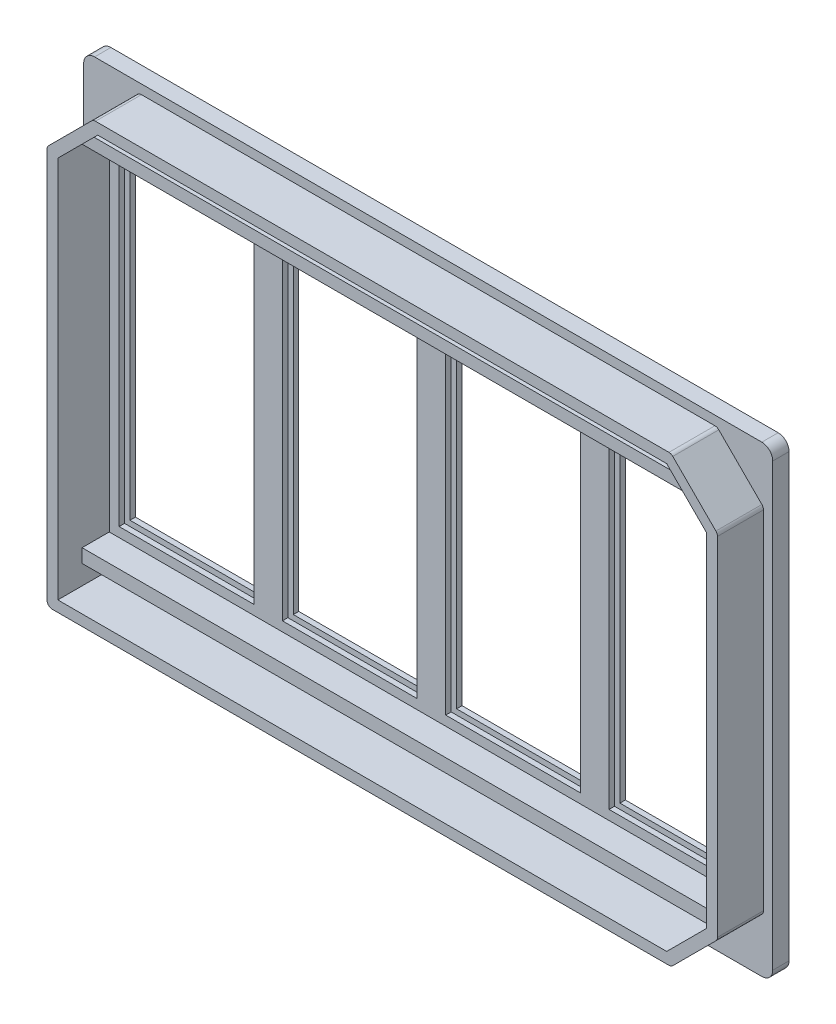
from build123d import *

# Parameters (mm, degrees)
SKETCH1_W           = 126.56
SKETCH1_H           = 85
BOSS_EXTRUDE1_DEPTH = 3
SKETCH2_W           = 123.16
SKETCH2_H           = 81.6
BOSS_EXTRUDE2_DEPTH = 8.45
CUT_EXTRUDE1_DEPTH  = 8.45
FILLET1_R           = 1
SHELL1_T            = -2
FILLET2_R           = 2
SKETCH4_W           = 24.75
SKETCH4_H           = 60.75
CUT_EXTRUDE2_DEPTH  = 1
SKETCH5_W           = 22.75
SKETCH5_H           = 58.75
CUT_EXTRUDE3_DEPTH  = 1
BOSS_EXTRUDE4_DEPTH = 5


with BuildPart() as part:
    # Sketch1 → Boss-Extrude1 (new body)
    with BuildSketch(Plane.XY):
        with Locations((63.28, 42.5)):
            Rectangle(SKETCH1_W, SKETCH1_H)
    extrude(amount=BOSS_EXTRUDE1_DEPTH)

    # Sketch2 → Boss-Extrude2 (add)
    with BuildSketch(Plane.XY.offset(3)):
        with Locations((63.28, 42.5)):
            Rectangle(SKETCH2_W, SKETCH2_H)
    extrude(amount=BOSS_EXTRUDE2_DEPTH)

    # Sketch3 → Cut-Extrude1 (cut)
    with BuildSketch(Plane.XY.offset(11.45)):
        Polygon((1.7, 83.3), (1.7, 74.8), (10.2, 83.3), align=None)
        Polygon((124.86, 83.3), (116.36, 83.3), (124.86, 74.8), align=None)
        Polygon((124.86, 1.7), (124.86, 10.2), (116.36, 1.7), align=None)
    extrude(amount=-CUT_EXTRUDE1_DEPTH, mode=Mode.SUBTRACT)

    # Fillet1
    fillet1_edges = [part.edges().sort_by_distance(p)[0] for p in [
        (1.7, 1.7, 7.225),
        (10.2, 83.3, 7.225),
        (1.7, 74.8, 7.225),
        (124.86, 74.8, 7.225),
        (116.36, 83.3, 7.225),
        (116.36, 1.7, 7.225),
        (124.86, 10.2, 7.225),
    ]]
    fillet(fillet1_edges, radius=FILLET1_R)

    # Shell1
    shell1_openings = [part.faces().sort_by_distance(p)[0] for p in [
        (63.067597632, 42.362751228, 11.45),
    ]]
    offset(amount=SHELL1_T, openings=shell1_openings, kind=Kind.INTERSECTION)

    # Fillet2
    fillet2_edges = [part.edges().sort_by_distance(p)[0] for p in [
        (0, 85, 1.5),
        (126.56, 85, 1.5),
        (126.56, 0, 1.5),
        (0, 0, 1.5),
    ]]
    fillet(fillet2_edges, radius=FILLET2_R)

    # Sketch4 → Cut-Extrude2 (cut)
    with BuildSketch(Plane.XY.offset(2)):
        with Locations((17.875, 41.925)):
            Rectangle(SKETCH4_W, SKETCH4_H)
        with Locations((47.875, 41.925)):
            Rectangle(SKETCH4_W, SKETCH4_H)
        with Locations((77.875, 41.925)):
            Rectangle(SKETCH4_W, SKETCH4_H)
        with Locations((107.875, 41.925)):
            Rectangle(SKETCH4_W, SKETCH4_H)
    extrude(amount=-CUT_EXTRUDE2_DEPTH, mode=Mode.SUBTRACT)

    # Sketch5 → Cut-Extrude3 (cut)
    with BuildSketch(Plane.XY.offset(1)):
        with Locations((17.875, 41.925)):
            Rectangle(SKETCH5_W, SKETCH5_H)
        with Locations((47.875, 41.925)):
            Rectangle(SKETCH5_W, SKETCH5_H)
        with Locations((77.875, 41.925)):
            Rectangle(SKETCH5_W, SKETCH5_H)
        with Locations((107.875, 41.925)):
            Rectangle(SKETCH5_W, SKETCH5_H)
    extrude(amount=-CUT_EXTRUDE3_DEPTH, mode=Mode.SUBTRACT)

    # Sketch7 → Boss-Extrude4 (add)
    with BuildSketch(Plane.XY.offset(2)):
        Polygon((3.7, 73.971572875), (122.86, 73.971572875), (120.655411021, 76.176161854), (5.904588979, 76.176161854), align=None)
        Polygon((3.7, 9.782267604), (3.7, 7.282267604), (119.195786438, 7.364213562), (121.613840479, 9.782267604), align=None)
    extrude(amount=BOSS_EXTRUDE4_DEPTH)


solid = part.part
